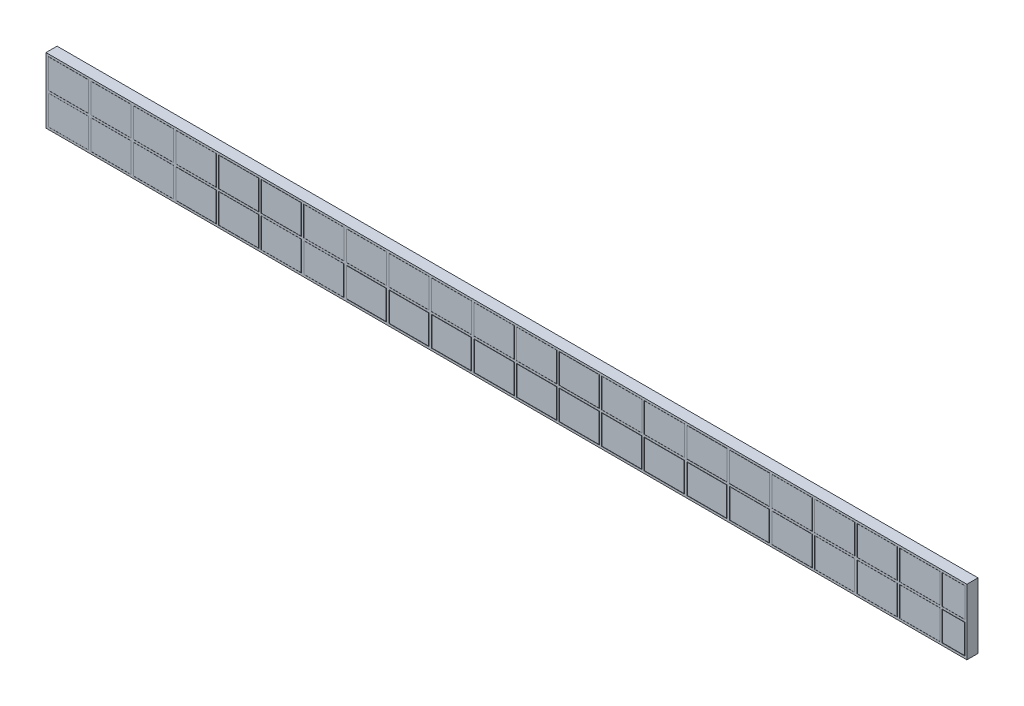
from build123d import *

# Parameters (mm, degrees)
CROQUIS1_W              = 18280
CROQUIS1_H              = 1300
SALIENTE_EXTRUIR1_DEPTH = 220
CROQUIS2_W              = 800
CROQUIS2_H              = 582.5
CROQUIS2_W_2            = 796.019634668
CROQUIS2_H_2            = 579.601796494
CROQUIS2_W_3            = 793.073011792
CROQUIS2_H_3            = 577.45628671
CROQUIS2_W_4            = 789.635724928
CROQUIS2_H_4            = 574.953512214
CROQUIS2_W_5            = 450
CROQUIS2_W_6            = 446.103569132
CROQUIS2_W_7            = 786.20600254
CROQUIS2_W_8            = 782.38790264
CROQUIS2_H_5            = 569.67619161
CROQUIS2_W_9            = 775.61341292
CROQUIS2_W_10           = 778.590260474
CROQUIS2_H_6            = 574.351960542
CROQUIS2_W_11           = 788.809559542
CROQUIS2_W_12           = 440.093195236
CORTAR_EXTRUIR1_DEPTH   = 220


with BuildPart() as part:
    # Croquis1 → Saliente-Extruir1 (new body)
    with BuildSketch(Plane.XY):
        Rectangle(CROQUIS1_W, CROQUIS1_H)
    extrude(amount=SALIENTE_EXTRUIR1_DEPTH)

    # Croquis2 → Cortar-Extruir1 (cut)
    # profile 1 of 44: a face of its own
    with BuildSketch(Plane.XY.offset(220)):
        with Locations((-8695, -313.75)):
            Rectangle(CROQUIS2_W, CROQUIS2_H)
        with Locations((-8695, -313.75)):
            Rectangle(CROQUIS2_W_2, CROQUIS2_H_2, mode=Mode.SUBTRACT)
    # profile 2 of 44: a face of its own
    with BuildSketch(Plane.XY.offset(220)):
        with Locations((-8695, 313.75)):
            Rectangle(CROQUIS2_W, CROQUIS2_H)
        with Locations((-8695, 313.75)):
            Rectangle(CROQUIS2_W_3, CROQUIS2_H_3, mode=Mode.SUBTRACT)
    # profile 3 of 44: a face of its own
    with BuildSketch(Plane.XY.offset(220)):
        with Locations((-7850, 313.75)):
            Rectangle(CROQUIS2_W, CROQUIS2_H)
        with Locations((-7850, 313.75)):
            Rectangle(CROQUIS2_W_3, CROQUIS2_H_3, mode=Mode.SUBTRACT)
    # profile 4 of 44: a face of its own
    with BuildSketch(Plane.XY.offset(220)):
        with Locations((-7850, -313.75)):
            Rectangle(CROQUIS2_W, CROQUIS2_H)
        with Locations((-7850, -313.75)):
            Rectangle(CROQUIS2_W_3, CROQUIS2_H_3, mode=Mode.SUBTRACT)
    # profile 5 of 44: a face of its own
    with BuildSketch(Plane.XY.offset(220)):
        with Locations((-7005, 313.75)):
            Rectangle(CROQUIS2_W, CROQUIS2_H)
        with Locations((-7005, 313.75)):
            Rectangle(CROQUIS2_W_3, CROQUIS2_H_3, mode=Mode.SUBTRACT)
    # profile 6 of 44: a face of its own
    with BuildSketch(Plane.XY.offset(220)):
        with Locations((-6160, 313.75)):
            Rectangle(CROQUIS2_W, CROQUIS2_H)
        with Locations((-6160, 313.75)):
            Rectangle(CROQUIS2_W_3, CROQUIS2_H_3, mode=Mode.SUBTRACT)
    # profile 7 of 44: a face of its own
    with BuildSketch(Plane.XY.offset(220)):
        with Locations((-5315, 313.75)):
            Rectangle(CROQUIS2_W, CROQUIS2_H)
        with Locations((-5315, 313.75)):
            Rectangle(CROQUIS2_W_4, CROQUIS2_H_4, mode=Mode.SUBTRACT)
    # profile 8 of 44: a face of its own
    with BuildSketch(Plane.XY.offset(220)):
        with Locations((-4470, 313.75)):
            Rectangle(CROQUIS2_W, CROQUIS2_H)
        with Locations((-4470, 313.75)):
            Rectangle(CROQUIS2_W_4, CROQUIS2_H_4, mode=Mode.SUBTRACT)
    # profile 9 of 44: a face of its own
    with BuildSketch(Plane.XY.offset(220)):
        with Locations((-3625, 313.75)):
            Rectangle(CROQUIS2_W, CROQUIS2_H)
        with Locations((-3625, 313.75)):
            Rectangle(CROQUIS2_W_3, CROQUIS2_H_3, mode=Mode.SUBTRACT)
    # profile 10 of 44: a face of its own
    with BuildSketch(Plane.XY.offset(220)):
        with Locations((-2780, 313.75)):
            Rectangle(CROQUIS2_W, CROQUIS2_H)
        with Locations((-2780, 313.75)):
            Rectangle(CROQUIS2_W_3, CROQUIS2_H_3, mode=Mode.SUBTRACT)
    # profile 11 of 44: a face of its own
    with BuildSketch(Plane.XY.offset(220)):
        with Locations((-1935, 313.75)):
            Rectangle(CROQUIS2_W, CROQUIS2_H)
        with Locations((-1935, 313.75)):
            Rectangle(CROQUIS2_W_3, CROQUIS2_H_3, mode=Mode.SUBTRACT)
    # profile 12 of 44: a face of its own
    with BuildSketch(Plane.XY.offset(220)):
        with Locations((-1090, 313.75)):
            Rectangle(CROQUIS2_W, CROQUIS2_H)
        with Locations((-1090, 313.75)):
            Rectangle(CROQUIS2_W_3, CROQUIS2_H_3, mode=Mode.SUBTRACT)
    # profile 13 of 44: a face of its own
    with BuildSketch(Plane.XY.offset(220)):
        with Locations((-245, 313.75)):
            Rectangle(CROQUIS2_W, CROQUIS2_H)
        with Locations((-245, 313.75)):
            Rectangle(CROQUIS2_W_3, CROQUIS2_H_3, mode=Mode.SUBTRACT)
    # profile 14 of 44: a face of its own
    with BuildSketch(Plane.XY.offset(220)):
        with Locations((600, 313.75)):
            Rectangle(CROQUIS2_W, CROQUIS2_H)
        with Locations((600, 313.75)):
            Rectangle(CROQUIS2_W_3, CROQUIS2_H_3, mode=Mode.SUBTRACT)
    # profile 15 of 44: a face of its own
    with BuildSketch(Plane.XY.offset(220)):
        with Locations((1445, 313.75)):
            Rectangle(CROQUIS2_W, CROQUIS2_H)
        with Locations((1445, 313.75)):
            Rectangle(CROQUIS2_W_4, CROQUIS2_H_4, mode=Mode.SUBTRACT)
    # profile 16 of 44: a face of its own
    with BuildSketch(Plane.XY.offset(220)):
        with Locations((2290, 313.75)):
            Rectangle(CROQUIS2_W, CROQUIS2_H)
        with Locations((2290, 313.75)):
            Rectangle(CROQUIS2_W_3, CROQUIS2_H_3, mode=Mode.SUBTRACT)
    # profile 17 of 44: a face of its own
    with BuildSketch(Plane.XY.offset(220)):
        with Locations((3135, 313.75)):
            Rectangle(CROQUIS2_W, CROQUIS2_H)
        with Locations((3135, 313.75)):
            Rectangle(CROQUIS2_W_3, CROQUIS2_H_3, mode=Mode.SUBTRACT)
    # profile 18 of 44: a face of its own
    with BuildSketch(Plane.XY.offset(220)):
        with Locations((3980, 313.75)):
            Rectangle(CROQUIS2_W, CROQUIS2_H)
        with Locations((3980, 313.75)):
            Rectangle(CROQUIS2_W_4, CROQUIS2_H_4, mode=Mode.SUBTRACT)
    # profile 19 of 44: a face of its own
    with BuildSketch(Plane.XY.offset(220)):
        with Locations((4825, 313.75)):
            Rectangle(CROQUIS2_W, CROQUIS2_H)
        with Locations((4825, 313.75)):
            Rectangle(CROQUIS2_W_4, CROQUIS2_H_4, mode=Mode.SUBTRACT)
    # profile 20 of 44: a face of its own
    with BuildSketch(Plane.XY.offset(220)):
        with Locations((5670, 313.75)):
            Rectangle(CROQUIS2_W, CROQUIS2_H)
        with Locations((5670, 313.75)):
            Rectangle(CROQUIS2_W_3, CROQUIS2_H_3, mode=Mode.SUBTRACT)
    # profile 21 of 44: a face of its own
    with BuildSketch(Plane.XY.offset(220)):
        with Locations((6515, 313.75)):
            Rectangle(CROQUIS2_W, CROQUIS2_H)
        with Locations((6515, 313.75)):
            Rectangle(CROQUIS2_W_3, CROQUIS2_H_3, mode=Mode.SUBTRACT)
    # profile 22 of 44: a face of its own
    with BuildSketch(Plane.XY.offset(220)):
        with Locations((7360, 313.75)):
            Rectangle(CROQUIS2_W, CROQUIS2_H)
        with Locations((7360, 313.75)):
            Rectangle(CROQUIS2_W_3, CROQUIS2_H_3, mode=Mode.SUBTRACT)
    # profile 23 of 44: a face of its own
    with BuildSketch(Plane.XY.offset(220)):
        with Locations((8205, 313.75)):
            Rectangle(CROQUIS2_W, CROQUIS2_H)
        with Locations((8205, 313.75)):
            Rectangle(CROQUIS2_W_3, CROQUIS2_H_3, mode=Mode.SUBTRACT)
    # profile 24 of 44: a face of its own
    with BuildSketch(Plane.XY.offset(220)):
        with Locations((8875, 313.75)):
            Rectangle(CROQUIS2_W_5, CROQUIS2_H)
        with Locations((8875, 313.75)):
            Rectangle(CROQUIS2_W_6, CROQUIS2_H_3, mode=Mode.SUBTRACT)
    # profile 25 of 44: a face of its own
    with BuildSketch(Plane.XY.offset(220)):
        with Locations((-7005, -313.75)):
            Rectangle(CROQUIS2_W, CROQUIS2_H)
        with Locations((-7005, -313.75)):
            Rectangle(CROQUIS2_W_3, CROQUIS2_H_3, mode=Mode.SUBTRACT)
    # profile 26 of 44: a face of its own
    with BuildSketch(Plane.XY.offset(220)):
        with Locations((-6160, -313.75)):
            Rectangle(CROQUIS2_W, CROQUIS2_H)
        with Locations((-6160, -313.75)):
            Rectangle(CROQUIS2_W_4, CROQUIS2_H_4, mode=Mode.SUBTRACT)
    # profile 27 of 44: a face of its own
    with BuildSketch(Plane.XY.offset(220)):
        with Locations((-5315, -313.75)):
            Rectangle(CROQUIS2_W, CROQUIS2_H)
        with Locations((-5315, -313.75)):
            Rectangle(CROQUIS2_W_4, CROQUIS2_H_4, mode=Mode.SUBTRACT)
    # profile 28 of 44: a face of its own
    with BuildSketch(Plane.XY.offset(220)):
        with Locations((-4470, -313.75)):
            Rectangle(CROQUIS2_W, CROQUIS2_H)
        with Locations((-4470, -313.75)):
            Rectangle(CROQUIS2_W_3, CROQUIS2_H_3, mode=Mode.SUBTRACT)
    # profile 29 of 44: a face of its own
    with BuildSketch(Plane.XY.offset(220)):
        with Locations((-3625, -313.75)):
            Rectangle(CROQUIS2_W_3, CROQUIS2_H)
        with Locations((-3625, -313.75)):
            Rectangle(CROQUIS2_W_7, CROQUIS2_H_3, mode=Mode.SUBTRACT)
    # profile 30 of 44: a face of its own
    with BuildSketch(Plane.XY.offset(220)):
        with Locations((-2780, -313.75)):
            Rectangle(CROQUIS2_W, CROQUIS2_H)
        with Locations((-2780, -313.75)):
            Rectangle(CROQUIS2_W_8, CROQUIS2_H_5, mode=Mode.SUBTRACT)
    # profile 31 of 44: a face of its own
    with BuildSketch(Plane.XY.offset(220)):
        with Locations((-1935, -313.75)):
            Rectangle(CROQUIS2_W, CROQUIS2_H)
        with Locations((-1935, -313.75)):
            Rectangle(CROQUIS2_W_8, CROQUIS2_H_5, mode=Mode.SUBTRACT)
    # profile 32 of 44: a face of its own
    with BuildSketch(Plane.XY.offset(220)):
        with Locations((-1090, -313.75)):
            Rectangle(CROQUIS2_W_3, CROQUIS2_H)
        with Locations((-1090, -313.75)):
            Rectangle(CROQUIS2_W_9, CROQUIS2_H_5, mode=Mode.SUBTRACT)
    # profile 33 of 44: a face of its own
    with BuildSketch(Plane.XY.offset(220)):
        with Locations((-245, -313.75)):
            Rectangle(CROQUIS2_W, CROQUIS2_H)
        with Locations((-245, -313.75)):
            Rectangle(CROQUIS2_W_8, CROQUIS2_H_5, mode=Mode.SUBTRACT)
    # profile 34 of 44: a face of its own
    with BuildSketch(Plane.XY.offset(220)):
        with Locations((600, -313.75)):
            Rectangle(CROQUIS2_W, CROQUIS2_H)
        with Locations((600, -313.75)):
            Rectangle(CROQUIS2_W_8, CROQUIS2_H_5, mode=Mode.SUBTRACT)
    # profile 35 of 44: a face of its own
    with BuildSketch(Plane.XY.offset(220)):
        with Locations((1445, -313.75)):
            Rectangle(CROQUIS2_W, CROQUIS2_H)
        with Locations((1445, -313.75)):
            Rectangle(CROQUIS2_W_8, CROQUIS2_H_5, mode=Mode.SUBTRACT)
    # profile 36 of 44: a face of its own
    with BuildSketch(Plane.XY.offset(220)):
        with Locations((2290, -313.75)):
            Rectangle(CROQUIS2_W, CROQUIS2_H)
        with Locations((2290, -313.75)):
            Rectangle(CROQUIS2_W_8, CROQUIS2_H_5, mode=Mode.SUBTRACT)
    # profile 37 of 44: a face of its own
    with BuildSketch(Plane.XY.offset(220)):
        with Locations((3135, -313.75)):
            Rectangle(CROQUIS2_W, CROQUIS2_H)
        with Locations((3135, -313.75)):
            Rectangle(CROQUIS2_W_8, CROQUIS2_H_5, mode=Mode.SUBTRACT)
    # profile 38 of 44: a face of its own
    with BuildSketch(Plane.XY.offset(220)):
        with Locations((3980, -313.75)):
            Rectangle(CROQUIS2_W, CROQUIS2_H)
        with Locations((3980, -313.75)):
            Rectangle(CROQUIS2_W_8, CROQUIS2_H_5, mode=Mode.SUBTRACT)
    # profile 39 of 44: a face of its own
    with BuildSketch(Plane.XY.offset(220)):
        with Locations((4825, -313.75)):
            Rectangle(CROQUIS2_W_4, CROQUIS2_H)
        with Locations((4825, -313.75)):
            Rectangle(CROQUIS2_W_10, CROQUIS2_H_6, mode=Mode.SUBTRACT)
    # profile 40 of 44: a face of its own
    with BuildSketch(Plane.XY.offset(220)):
        with Locations((5670, -313.75)):
            Rectangle(CROQUIS2_W, CROQUIS2_H)
        with Locations((5670, -313.75)):
            Rectangle(CROQUIS2_W_11, CROQUIS2_H_6, mode=Mode.SUBTRACT)
    # profile 41 of 44: a face of its own
    with BuildSketch(Plane.XY.offset(220)):
        with Locations((6515, -313.75)):
            Rectangle(CROQUIS2_W_3, CROQUIS2_H)
        with Locations((6515, -313.75)):
            Rectangle(CROQUIS2_W_7, CROQUIS2_H_3, mode=Mode.SUBTRACT)
    # profile 42 of 44: a face of its own
    with BuildSketch(Plane.XY.offset(220)):
        with Locations((7360, -313.75)):
            Rectangle(CROQUIS2_W, CROQUIS2_H)
        with Locations((7360, -313.75)):
            Rectangle(CROQUIS2_W_3, CROQUIS2_H_3, mode=Mode.SUBTRACT)
    # profile 43 of 44: a face of its own
    with BuildSketch(Plane.XY.offset(220)):
        with Locations((8205, -313.75)):
            Rectangle(CROQUIS2_W, CROQUIS2_H)
        with Locations((8205, -313.75)):
            Rectangle(CROQUIS2_W_3, CROQUIS2_H_3, mode=Mode.SUBTRACT)
    # profile 44 of 44: a face of its own
    with BuildSketch(Plane.XY.offset(220)):
        with Locations((8875, -313.75)):
            Rectangle(CROQUIS2_W_5, CROQUIS2_H)
        with Locations((8875, -313.75)):
            Rectangle(CROQUIS2_W_12, CROQUIS2_H_5, mode=Mode.SUBTRACT)
    extrude(amount=-CORTAR_EXTRUIR1_DEPTH, mode=Mode.SUBTRACT)


solid = part.part
